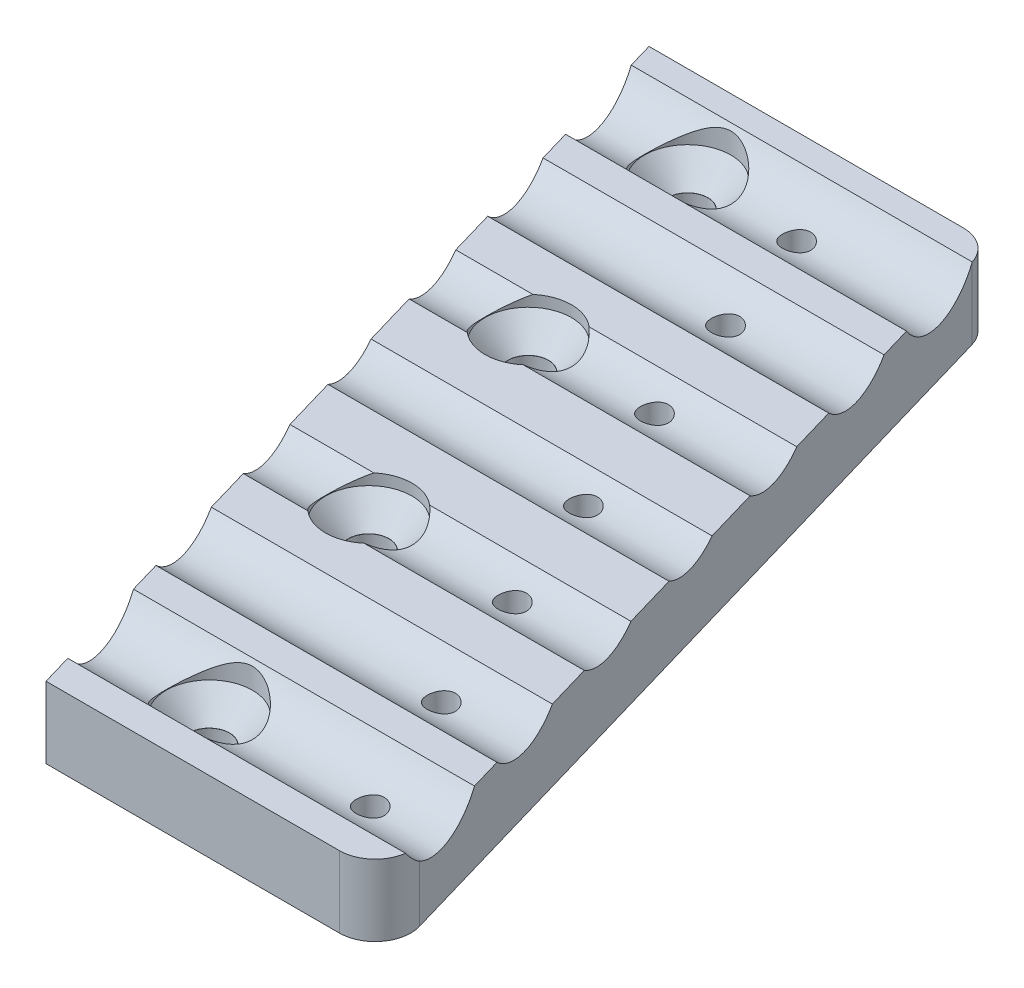
from build123d import *

# Parameters (mm, degrees)
BOSS_EXTRUDE2_DEPTH = 6.35
SKETCH7_R           = 5
CUT_EXTRUDE1_DEPTH  = 74.422
SKETCH22_R          = 1.7907
CUT_EXTRUDE2_DEPTH  = 74.422
SKETCH21_R          = 1.25
CUT_EXTRUDE3_DEPTH  = 74.422


with BuildPart() as part:
    # Sketch3 → Boss-Extrude2 (new body)
    with BuildSketch(Plane(origin=(0, 0, 0), x_dir=(1, 0, 0), z_dir=(0, 1, 0))):
        with BuildLine():
            Line((30.988, 73.406), (51.21275, 4.064))
            ThreePointArc((51.21275, 4.064), (50.70475, 1.27), (48.16475, 0))
            Line((48.16475, 0), (22.076833333, 0))
            Line((22.076833333, 0), (0, 75.692))
            Line((0, 75.692), (27.94, 75.692))
            ThreePointArc((27.94, 75.692), (29.845, 75.057), (30.988, 73.406))
        make_face()
    extrude(amount=-BOSS_EXTRUDE2_DEPTH)

    # Sketch7 → Cut-Extrude1 (cut)
    with BuildSketch(Plane(origin=(0, 0, 0), x_dir=(0, 0, -1), z_dir=(1, 0, 0))):
        with Locations((6.857884732, 2.831164756)):
            Circle(SKETCH7_R)
        with Locations((17.279310179, 3.596191936)):
            Circle(SKETCH7_R)
        with Locations((27.691863994, 4.053898332)):
            Circle(SKETCH7_R)
        with Locations((38.1, 4.20625)):
            Circle(SKETCH7_R)
        with Locations((48.508136006, 4.053898332)):
            Circle(SKETCH7_R)
        with Locations((58.920689821, 3.596191936)):
            Circle(SKETCH7_R)
        with Locations((69.342115268, 2.831164756)):
            Circle(SKETCH7_R)
    extrude(amount=CUT_EXTRUDE1_DEPTH, mode=Mode.SUBTRACT)

    # Sketch22 → Cut-Extrude2 (cut)
    with BuildSketch(Plane(origin=(0, 0, 0), x_dir=(1, 0, 0), z_dir=(0, 1, 0))):
        with Locations(Location((9.789583333, 69.342, 0), (0, 0, 270))):
            Circle(SKETCH22_R)
        with Locations(Location((16.439386687, 48.514, 0), (0, 0, 270))):
            Circle(SKETCH22_R)
        with Locations(Location((23.08919004, 27.686, 0), (0, 0, 270))):
            Circle(SKETCH22_R)
        with Locations(Location((29.738993393, 6.858, 0), (0, 0, 270))):
            Circle(SKETCH22_R)
    extrude(amount=-CUT_EXTRUDE2_DEPTH, mode=Mode.SUBTRACT)

    # Sketch21 → Cut-Extrude3 (cut)
    with BuildSketch(Plane(origin=(0, 0, 0), x_dir=(1, 0, 0), z_dir=(0, 1, 0))):
        with Locations(Location((19.473333333, 69.342, 0), (0, 0, 270))):
            Circle(SKETCH21_R)
        with Locations(Location((23.568118499, 58.928, 0), (0, 0, 270))):
            Circle(SKETCH21_R)
        with Locations(Location((27.662903665, 48.514, 0), (0, 0, 270))):
            Circle(SKETCH21_R)
        with Locations(Location((31.757688831, 38.1, 0), (0, 0, 270))):
            Circle(SKETCH21_R)
        with Locations(Location((35.852473996, 27.686, 0), (0, 0, 270))):
            Circle(SKETCH21_R)
        with Locations(Location((39.947259162, 17.272, 0), (0, 0, 270))):
            Circle(SKETCH21_R)
        with Locations(Location((44.042044328, 6.858, 0), (0, 0, 270))):
            Circle(SKETCH21_R)
    extrude(amount=-CUT_EXTRUDE3_DEPTH, mode=Mode.SUBTRACT)

    # Sketch24 → Cut-Revolve1 (revolve, cut)
    with BuildSketch(Plane(origin=(9.789583333, 0, 0), x_dir=(0, 0, -1), z_dir=(1, 0, 0)), mode=Mode.PRIVATE) as cut_revolve1_sk:
        Polygon((69.342, 1.594870185), (69.342, -2.168835243), (69.342, -4.480235243), (71.1454, -4.480235243), (73.184910088, -2.215129815), (73.184910088, 1.594870185), align=None)
    revolve(cut_revolve1_sk.sketch.rotate(Axis((9.789583333, 1.594870185, -69.342), (0, -1, 0)), 180), axis=Axis((9.789583333, 1.594870185, -69.342), (0, -1, 0)), mode=Mode.SUBTRACT)

    # Sketch26 → Cut-Revolve2 (revolve, cut)
    with BuildSketch(Plane(origin=(16.439386687, 0, 0), x_dir=(0, 0, -1), z_dir=(1, 0, 0)), mode=Mode.PRIVATE) as cut_revolve2_sk:
        Polygon((48.514, -0.946098229), (48.514, -3.257498229), (50.3174, -3.257498229), (52.356910088, -0.992392801), (52.356910088, 3.057918479), (48.514, 3.057918479), align=None)
    revolve(cut_revolve2_sk.sketch.rotate(Axis((16.439386687, 3.057918479, -48.514), (0, -1, 0)), 180), axis=Axis((16.439386687, 3.057918479, -48.514), (0, -1, 0)), mode=Mode.SUBTRACT)

    # Sketch28 → Cut-Revolve3 (revolve, cut)
    with BuildSketch(Plane(origin=(23.08919004, 0, 0), x_dir=(0, 0, -1), z_dir=(1, 0, 0))):
        Polygon((27.686, 3.057918479), (27.686, -0.946098229), (27.686, -3.257498229), (25.8826, -3.257498229), (23.843089912, -0.992392801), (23.843089912, 3.057918479), align=None)
    revolve(axis=Axis((23.08919004, 3.057918479, -27.686), (0, -1, 0)), mode=Mode.SUBTRACT)

    # Sketch29 → Cut-Revolve4 (revolve, cut)
    with BuildSketch(Plane(origin=(29.738993393, 0, 0), x_dir=(0, 0, -1), z_dir=(1, 0, 0))):
        Polygon((3.015089912, 1.594870185), (6.858, 1.594870185), (6.858, -2.168835243), (6.858, -4.480235243), (5.0546, -4.480235243), (3.015089912, -2.215129815), align=None)
    revolve(axis=Axis((29.738993393, 1.594870185, -6.858), (0, -1, 0)), mode=Mode.SUBTRACT)


solid = part.part
